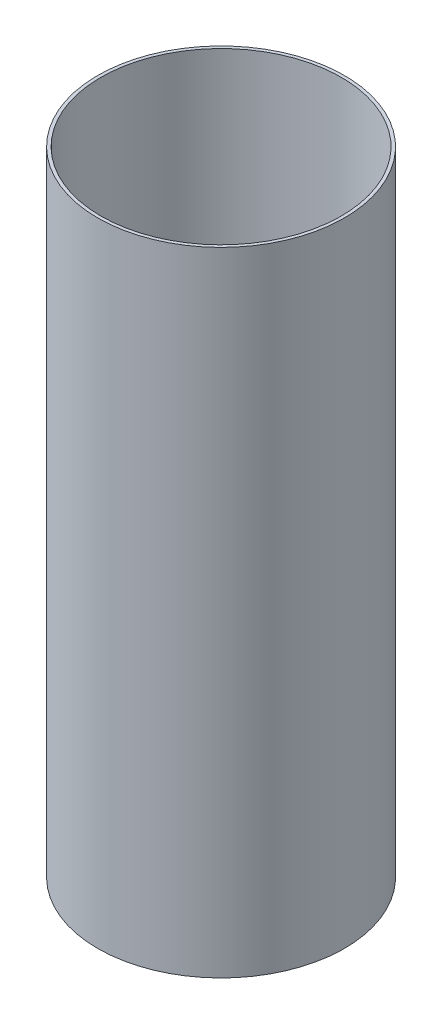
from build123d import *

# Parameters (mm, degrees)
SKETCH_1_R      = 78
SKETCH_1_R_2    = 76
EXTRUDE_1_DEPTH = 400


with BuildPart() as part:
    # Эскиз1 → Бобышка-Вытянуть1 (new body)
    with BuildSketch(Plane(origin=(0, 0, 0), x_dir=(1, 0, 0), z_dir=(0, 1, 0))):
        with Locations(Location((0, 0, 0), (0, 0, 270))):
            Circle(SKETCH_1_R)
        with Locations(Location((0, 0, 0), (0, 0, 270))):
            Circle(SKETCH_1_R_2, mode=Mode.SUBTRACT)
    extrude(amount=EXTRUDE_1_DEPTH)


solid = part.part
